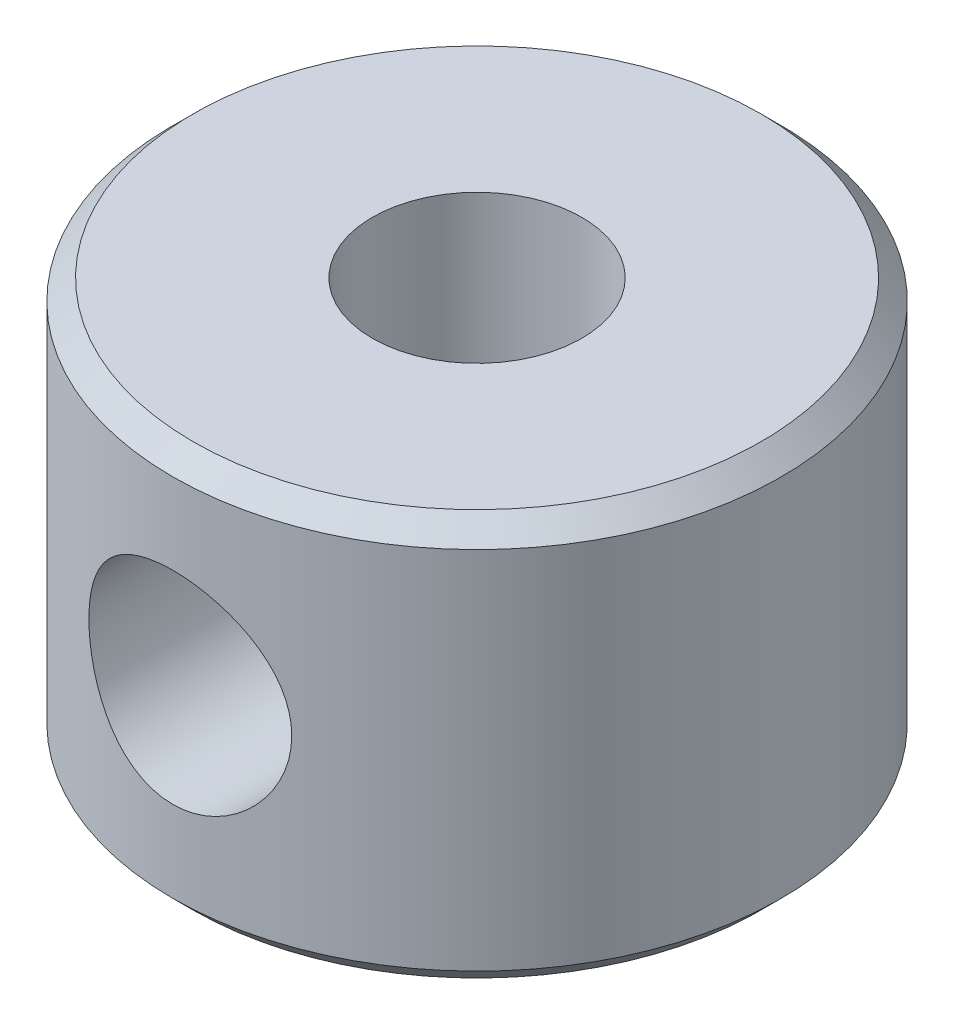
from build123d import *

# Parameters (mm, degrees)
CROQUIS1_R                                     = 4.5
SALIENTE_EXTRUIR1_DEPTH                        = 6
CHAFL_N1_SIZE                                  = 0.3
CHAFL_N2_SIZE                                  = 0.3
CROQUIS2_R                                     = 1.55
CORTAR_EXTRUIR2_DEPTH                          = 6
PERFORADOR_PARA_ROSCAR_HELICOIL_DE_M2_21_REACH = 12.502
PERFORADOR_PARA_ROSCAR_HELICOIL_DE_M_2_R       = 1.5


with BuildPart() as part:
    # Croquis1 → Saliente-Extruir1 (new body)
    with BuildSketch(Plane(origin=(0, 0, 0), x_dir=(1, 0, 0), z_dir=(0, 1, 0))):
        with Locations(Location((0, 0, 0), (0, 0, 270))):
            Circle(CROQUIS1_R)
    extrude(amount=SALIENTE_EXTRUIR1_DEPTH)

    # Chaflán1
    chafl_n1_edges = [part.edges().sort_by_distance(p)[0] for p in [
        (0, 6, -4.5),
    ]]
    chamfer(chafl_n1_edges, length=CHAFL_N1_SIZE)

    # Chaflán2
    chafl_n2_edges = [part.edges().sort_by_distance(p)[0] for p in [
        (0, 0, -4.5),
    ]]
    chamfer(chafl_n2_edges, length=CHAFL_N2_SIZE)

    # Croquis2 → Cortar-Extruir2 (cut)
    with BuildSketch(Plane(origin=(0, 6, 0), x_dir=(1, 0, 0), z_dir=(0, 1, 0))):
        with Locations(Location((0, 0, 0), (0, 0, 270))):
            Circle(CROQUIS2_R)
    extrude(amount=-CORTAR_EXTRUIR2_DEPTH, mode=Mode.SUBTRACT)

    # Perforador para roscar Helicoil de M 2 (on position points) → Perforador para roscar Helicoil de M2.21 (cut, up to next)
    with BuildSketch(Plane(origin=(0.001317156, 3.003898977, 4.499999807), x_dir=(0.999999957163, 0, -0.000292701404), z_dir=(0.000292701404, 0, 0.999999957163)), mode=Mode.PRIVATE) as perforador_para_roscar_helicoil_de_m2_21_sk1:
        Circle(PERFORADOR_PARA_ROSCAR_HELICOIL_DE_M_2_R)
    perforador_para_roscar_helicoil_de_m2_21_tool1 = extrude(perforador_para_roscar_helicoil_de_m2_21_sk1.sketch, amount=-PERFORADOR_PARA_ROSCAR_HELICOIL_DE_M2_21_REACH, mode=Mode.PRIVATE) & part.part
    add(perforador_para_roscar_helicoil_de_m2_21_tool1.solids().sort_by_distance((0.001317, 3.003899, 4.5))[0], mode=Mode.SUBTRACT)


solid = part.part
